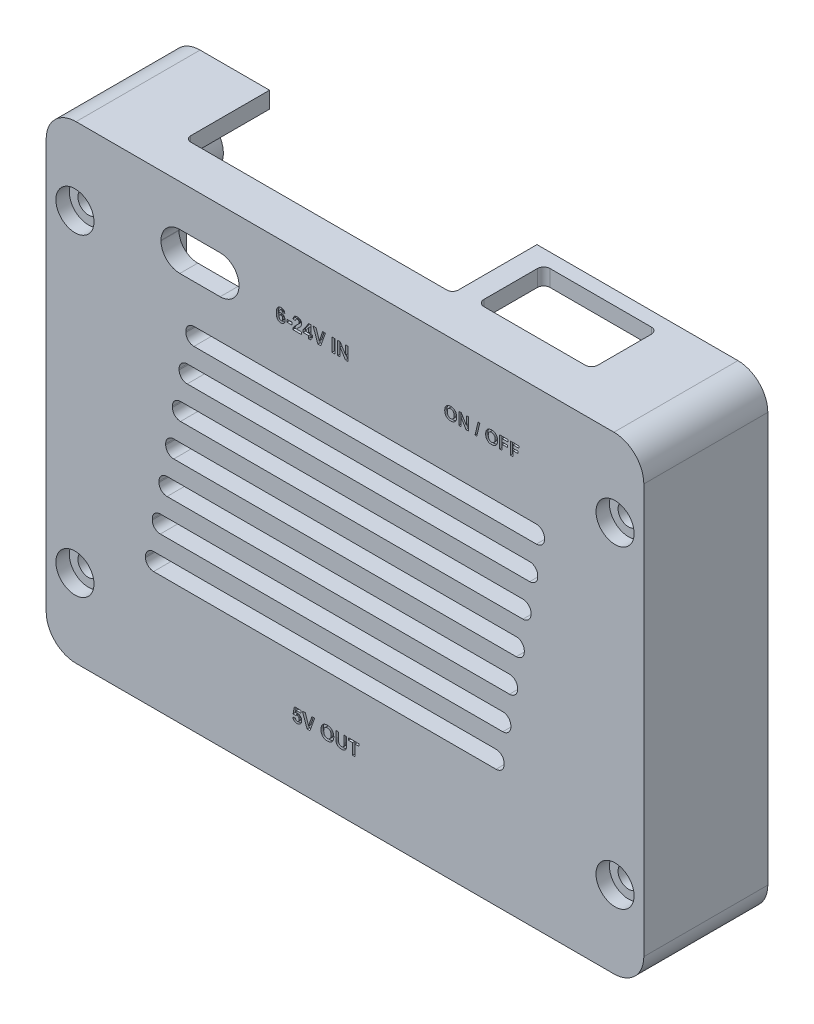
from build123d import *

# Parameters (mm, degrees)
UPPER_CASE_BLANK_START                       = 8
UPPER_CASE_BLANK_DEPTH                       = 16.6
UPPER_CASE_CAVITY_2P2_WALL_START             = 7.5
UPPER_CASE_CAVITY_2P2_WALL_DEPTH             = 14.7
UPPER_LID_SCREW_GUIDES_START                 = 8
UPPER_LID_SCREW_GUIDES_PROFILE_R             = 3.27
UPPER_LID_SCREW_GUIDES_DEPTH                 = 14.3
FOUR_M2P5_LID_CLEARANCE_HOLES_D2P8_START     = 7.5
LID_M2P5_CLEARANCE_PROFILES_R                = 1.4
FOUR_M2P5_LID_CLEARANCE_HOLES_D2P8_DEPTH     = 17.6
FOUR_D5P1_HEAD_COUNTERBORES_START            = 22.8
LID_SCREW_HEAD_RECESS_PROFILES_R             = 2.55
FOUR_D5P1_HEAD_COUNTERBORES_DEPTH            = 2.2
ROOF_VENT_SLOTS_START                        = 21.9
ROOF_VENT_SLOTS_DEPTH                        = 3.05
TWO_KF301_DRIVER_ACCESS_D4P9_START           = 21.9
TERMINAL_DRIVER_ACCESS_PROFILES_R            = 2.45
TWO_KF301_DRIVER_ACCESS_D4P9_DEPTH           = 3.05
OUTPUT_WINDOWS_USB_C_PH_DC_HEADER_START      = -32.4
OUTPUT_WINDOWS_USB_C_PH_DC_HEADER_DEPTH      = 3.9
INPUT_WINDOWS_KF301_XH_DC_SWITCH_START       = 32.4
INPUT_WINDOWS_KF301_XH_DC_SWITCH_DEPTH       = 3.9
INPUT_LABEL_START                            = 24.29
INPUT_LABEL_LETTER_PROFILES_W                = 0.66647
INPUT_LABEL_LETTER_PROFILES_H                = 0.33927
INPUT_LABEL_LETTER_PROFILES_W_2              = 0.35738
INPUT_LABEL_LETTER_PROFILES_H_2              = 1.77
INPUT_LABEL_DEPTH                            = 0.5
OUTPUT_LABEL_START                           = 24.29
OUTPUT_LABEL_DEPTH                           = 0.5
SWITCH_LABEL_START                           = 24.29
SWITCH_LABEL_DEPTH                           = 0.5
CONTINUOUS_TERMINAL_DRIVER_ACCESS_SLOT_START = 21.92
CONTINUOUS_TERMINAL_DRIVER_ACCESS_SLOT_DEPTH = 2.95


with BuildPart() as part:
    # Lid_Envelope_80x62p8_R4 → Upper_Case_Blank (new body)
    with BuildSketch(Plane.XY.offset(UPPER_CASE_BLANK_START)):
        with BuildLine():
            Line((-36, -31.4), (36, -31.4))
            ThreePointArc((36, -31.4), (38.828427125, -30.228427125), (40, -27.4))
            Line((40, -27.4), (40, 27.4))
            ThreePointArc((40, 27.4), (38.828427125, 30.228427125), (36, 31.4))
            Line((36, 31.4), (-36, 31.4))
            ThreePointArc((-36, 31.4), (-38.828427125, 30.228427125), (-40, 27.4))
            Line((-40, 27.4), (-40, -27.4))
            ThreePointArc((-40, -27.4), (-38.828427125, -30.228427125), (-36, -31.4))
        make_face()
    extrude(amount=UPPER_CASE_BLANK_DEPTH)

    # Upper_Case_Cavity_2p2_Wall_Profile → Upper_Case_Cavity_2p2_Wall (cut)
    with BuildSketch(Plane.XY.offset(UPPER_CASE_CAVITY_2P2_WALL_START)):
        with BuildLine():
            Line((-36, -29.2), (36, -29.2))
            ThreePointArc((36, -29.2), (37.272792206, -28.672792206), (37.8, -27.4))
            Line((37.8, -27.4), (37.8, 27.4))
            ThreePointArc((37.8, 27.4), (37.272792206, 28.672792206), (36, 29.2))
            Line((36, 29.2), (-36, 29.2))
            ThreePointArc((-36, 29.2), (-37.272792206, 28.672792206), (-37.8, 27.4))
            Line((-37.8, 27.4), (-37.8, -27.4))
            ThreePointArc((-37.8, -27.4), (-37.272792206, -28.672792206), (-36, -29.2))
        make_face()
    extrude(amount=UPPER_CASE_CAVITY_2P2_WALL_DEPTH, mode=Mode.SUBTRACT)

    # Upper_Lid_Screw_Guides_Profile → Upper_Lid_Screw_Guides (add)
    with BuildSketch(Plane.XY.offset(UPPER_LID_SCREW_GUIDES_START)):
        with Locations((-36.15, -21)):
            Circle(UPPER_LID_SCREW_GUIDES_PROFILE_R)
        with Locations((-36.15, 21)):
            Circle(UPPER_LID_SCREW_GUIDES_PROFILE_R)
        with Locations((36.15, -21)):
            Circle(UPPER_LID_SCREW_GUIDES_PROFILE_R)
        with Locations((36.15, 21)):
            Circle(UPPER_LID_SCREW_GUIDES_PROFILE_R)
    extrude(amount=UPPER_LID_SCREW_GUIDES_DEPTH)

    # Lid_M2p5_Clearance_Profiles → Four_M2p5_Lid_Clearance_Holes_D2p8 (cut)
    with BuildSketch(Plane.XY.offset(FOUR_M2P5_LID_CLEARANCE_HOLES_D2P8_START)):
        with Locations((-36.15, -21)):
            Circle(LID_M2P5_CLEARANCE_PROFILES_R)
        with Locations((-36.15, 21)):
            Circle(LID_M2P5_CLEARANCE_PROFILES_R)
        with Locations((36.15, -21)):
            Circle(LID_M2P5_CLEARANCE_PROFILES_R)
        with Locations((36.15, 21)):
            Circle(LID_M2P5_CLEARANCE_PROFILES_R)
    extrude(amount=FOUR_M2P5_LID_CLEARANCE_HOLES_D2P8_DEPTH, mode=Mode.SUBTRACT)

    # Lid_Screw_Head_Recess_Profiles → Four_D5p1_Head_Counterbores (cut)
    with BuildSketch(Plane.XY.offset(FOUR_D5P1_HEAD_COUNTERBORES_START)):
        with Locations((-36.15, -21)):
            Circle(LID_SCREW_HEAD_RECESS_PROFILES_R)
        with Locations((-36.15, 21)):
            Circle(LID_SCREW_HEAD_RECESS_PROFILES_R)
        with Locations((36.15, -21)):
            Circle(LID_SCREW_HEAD_RECESS_PROFILES_R)
        with Locations((36.15, 21)):
            Circle(LID_SCREW_HEAD_RECESS_PROFILES_R)
    extrude(amount=FOUR_D5P1_HEAD_COUNTERBORES_DEPTH, mode=Mode.SUBTRACT)

    # Seven_Roof_Vent_Profiles → Roof_Vent_Slots (cut)
    with BuildSketch(Plane.XY.offset(ROOF_VENT_SLOTS_START)):
        with BuildLine():
            Line((-25.62, -15.56), (20.22, -15.56))
            ThreePointArc((20.22, -15.56), (20.983675324, -15.243675324), (21.3, -14.48))
            Line((21.3, -14.48), (21.3, -14.32))
            ThreePointArc((21.3, -14.32), (20.983675324, -13.556324676), (20.22, -13.24))
            Line((20.22, -13.24), (-25.62, -13.24))
            ThreePointArc((-25.62, -13.24), (-26.383675324, -13.556324676), (-26.7, -14.32))
            Line((-26.7, -14.32), (-26.7, -14.48))
            ThreePointArc((-26.7, -14.48), (-26.383675324, -15.243675324), (-25.62, -15.56))
        make_face()
        with BuildLine():
            Line((-24.72, -10.76), (21.12, -10.76))
            ThreePointArc((21.12, -10.76), (21.883675324, -10.443675324), (22.2, -9.68))
            Line((22.2, -9.68), (22.2, -9.52))
            ThreePointArc((22.2, -9.52), (21.883675324, -8.756324676), (21.12, -8.44))
            Line((21.12, -8.44), (-24.72, -8.44))
            ThreePointArc((-24.72, -8.44), (-25.483675324, -8.756324676), (-25.8, -9.52))
            Line((-25.8, -9.52), (-25.8, -9.68))
            ThreePointArc((-25.8, -9.68), (-25.483675324, -10.443675324), (-24.72, -10.76))
        make_face()
        with BuildLine():
            Line((-23.82, -5.96), (22.02, -5.96))
            ThreePointArc((22.02, -5.96), (22.783675324, -5.643675324), (23.1, -4.88))
            Line((23.1, -4.88), (23.1, -4.72))
            ThreePointArc((23.1, -4.72), (22.783675324, -3.956324676), (22.02, -3.64))
            Line((22.02, -3.64), (-23.82, -3.64))
            ThreePointArc((-23.82, -3.64), (-24.583675324, -3.956324676), (-24.9, -4.72))
            Line((-24.9, -4.72), (-24.9, -4.88))
            ThreePointArc((-24.9, -4.88), (-24.583675324, -5.643675324), (-23.82, -5.96))
        make_face()
        with BuildLine():
            Line((-22.92, -1.16), (22.92, -1.16))
            ThreePointArc((22.92, -1.16), (23.683675324, -0.843675324), (24, -0.08))
            Line((24, -0.08), (24, 0.08))
            ThreePointArc((24, 0.08), (23.683675324, 0.843675324), (22.92, 1.16))
            Line((22.92, 1.16), (-22.92, 1.16))
            ThreePointArc((-22.92, 1.16), (-23.683675324, 0.843675324), (-24, 0.08))
            Line((-24, 0.08), (-24, -0.08))
            ThreePointArc((-24, -0.08), (-23.683675324, -0.843675324), (-22.92, -1.16))
        make_face()
        with BuildLine():
            Line((-22.02, 3.64), (23.82, 3.64))
            ThreePointArc((23.82, 3.64), (24.583675324, 3.956324676), (24.9, 4.72))
            Line((24.9, 4.72), (24.9, 4.88))
            ThreePointArc((24.9, 4.88), (24.583675324, 5.643675324), (23.82, 5.96))
            Line((23.82, 5.96), (-22.02, 5.96))
            ThreePointArc((-22.02, 5.96), (-22.783675324, 5.643675324), (-23.1, 4.88))
            Line((-23.1, 4.88), (-23.1, 4.72))
            ThreePointArc((-23.1, 4.72), (-22.783675324, 3.956324676), (-22.02, 3.64))
        make_face()
        with BuildLine():
            Line((-21.12, 8.44), (24.72, 8.44))
            ThreePointArc((24.72, 8.44), (25.483675324, 8.756324676), (25.8, 9.52))
            Line((25.8, 9.52), (25.8, 9.68))
            ThreePointArc((25.8, 9.68), (25.483675324, 10.443675324), (24.72, 10.76))
            Line((24.72, 10.76), (-21.12, 10.76))
            ThreePointArc((-21.12, 10.76), (-21.883675324, 10.443675324), (-22.2, 9.68))
            Line((-22.2, 9.68), (-22.2, 9.52))
            ThreePointArc((-22.2, 9.52), (-21.883675324, 8.756324676), (-21.12, 8.44))
        make_face()
        with BuildLine():
            Line((-20.22, 13.24), (25.62, 13.24))
            ThreePointArc((25.62, 13.24), (26.383675324, 13.556324676), (26.7, 14.32))
            Line((26.7, 14.32), (26.7, 14.48))
            ThreePointArc((26.7, 14.48), (26.383675324, 15.243675324), (25.62, 15.56))
            Line((25.62, 15.56), (-20.22, 15.56))
            ThreePointArc((-20.22, 15.56), (-20.983675324, 15.243675324), (-21.3, 14.48))
            Line((-21.3, 14.48), (-21.3, 14.32))
            ThreePointArc((-21.3, 14.32), (-20.983675324, 13.556324676), (-20.22, 13.24))
        make_face()
    extrude(amount=ROOF_VENT_SLOTS_DEPTH, mode=Mode.SUBTRACT)

    # Terminal_Driver_Access_Profiles → Two_KF301_Driver_Access_D4p9 (cut)
    with BuildSketch(Plane.XY.offset(TWO_KF301_DRIVER_ACCESS_D4P9_START)):
        with Locations((-21.95, 23.3)):
            Circle(TERMINAL_DRIVER_ACCESS_PROFILES_R)
        with Locations((-16.87, 23.3)):
            Circle(TERMINAL_DRIVER_ACCESS_PROFILES_R)
    extrude(amount=TWO_KF301_DRIVER_ACCESS_D4P9_DEPTH, mode=Mode.SUBTRACT)

    # Output_Windows_USB_C_PH_DC_Header_Profile → Output_Windows_USB_C_PH_DC_Header (cut)
    with BuildSketch(Plane(origin=(0, 0, 0), x_dir=(1, 0, 0), z_dir=(0, 1, 0)).offset(OUTPUT_WINDOWS_USB_C_PH_DC_HEADER_START)):
        with BuildLine():
            Line((10.62, -15.25), (25.6, -15.25))
            ThreePointArc((25.6, -15.25), (26.094974747, -15.044974747), (26.3, -14.55))
            Line((26.3, -14.55), (26.3, -6.85))
            ThreePointArc((26.3, -6.85), (26.094974747, -6.355025253), (25.6, -6.15))
            Line((25.6, -6.15), (10.62, -6.15))
            ThreePointArc((10.62, -6.15), (10.125025253, -6.355025253), (9.92, -6.85))
            Line((9.92, -6.85), (9.92, -14.55))
            ThreePointArc((9.92, -14.55), (10.125025253, -15.044974747), (10.62, -15.25))
        make_face()
        Polygon((-28.53, -5.65), (7.8, -5.65), (8.45, -6.3), (8.45, -17.9), (7.8, -18.55), (-3.4, -18.55), (-4.05, -17.9), (-4.05, -14.03), (-4.7, -13.38), (-28.53, -13.38), (-29.18, -12.73), (-29.18, -6.3), align=None)
    extrude(amount=OUTPUT_WINDOWS_USB_C_PH_DC_HEADER_DEPTH, mode=Mode.SUBTRACT)

    # Input_Windows_KF301_XH_DC_Switch_Profile → Input_Windows_KF301_XH_DC_Switch (cut)
    with BuildSketch(Plane(origin=(0, 0, 0), x_dir=(1, 0, 0), z_dir=(0, 1, 0)).offset(INPUT_WINDOWS_KF301_XH_DC_SWITCH_START)):
        with BuildLine():
            Line((-25.95, -19.3), (8.35, -19.3))
            ThreePointArc((8.35, -19.3), (8.880330086, -19.080330086), (9.1, -18.55))
            Line((9.1, -18.55), (9.1, -6.9))
            ThreePointArc((9.1, -6.9), (8.880330086, -6.369669914), (8.35, -6.15))
            Line((8.35, -6.15), (-25.95, -6.15))
            ThreePointArc((-25.95, -6.15), (-26.480330086, -6.369669914), (-26.7, -6.9))
            Line((-26.7, -6.9), (-26.7, -18.55))
            ThreePointArc((-26.7, -18.55), (-26.480330086, -19.080330086), (-25.95, -19.3))
        make_face()
        with BuildLine():
            Line((12.75, -18.75), (26.3, -18.75))
            ThreePointArc((26.3, -18.75), (26.901040764, -18.501040764), (27.15, -17.9))
            Line((27.15, -17.9), (27.15, -10.75))
            ThreePointArc((27.15, -10.75), (26.901040764, -10.148959236), (26.3, -9.9))
            Line((26.3, -9.9), (12.75, -9.9))
            ThreePointArc((12.75, -9.9), (12.148959236, -10.148959236), (11.9, -10.75))
            Line((11.9, -10.75), (11.9, -17.9))
            ThreePointArc((11.9, -17.9), (12.148959236, -18.501040764), (12.75, -18.75))
        make_face()
    extrude(amount=-INPUT_WINDOWS_KF301_XH_DC_SWITCH_DEPTH, mode=Mode.SUBTRACT)

    # Input_Label_Letter_Profiles → Input_Label (cut)
    # profile 1 of 7: a face of its own
    with BuildSketch(Plane.XY.offset(INPUT_LABEL_START)):
        Polygon((-8.04555, 23.13656), (-8.37395, 23.10033), (-8.39568, 23.18847), (-8.43673, 23.25005), (-8.49499, 23.28627), (-8.56834, 23.29834), (-8.66749, 23.2742), (-8.75004, 23.20175), (-8.78374, 23.1404), (-8.81056, 23.05295), (-8.83052, 22.93938), (-8.84362, 22.7997), (-8.75226, 22.88287), (-8.64722, 22.93278), (-8.52849, 22.94941), (-8.42605, 22.9393), (-8.33124, 22.90897), (-8.24404, 22.85841), (-8.16447, 22.78763), (-8.09818, 22.70085), (-8.05083, 22.6023), (-8.02242, 22.49197), (-8.01295, 22.36988), (-8.01932, 22.26551), (-8.03845, 22.16974), (-8.07032, 22.08257), (-8.11495, 22.004), (-8.17232, 21.93402), (-8.25766, 21.86218), (-8.35433, 21.81087), (-8.46231, 21.78008), (-8.58162, 21.76982), (-8.68502, 21.77815), (-8.78078, 21.80314), (-8.86892, 21.84479), (-8.94943, 21.90311), (-9.02231, 21.97809), (-9.08446, 22.07204), (-9.1328, 22.1873), (-9.16733, 22.32385), (-9.18805, 22.4817), (-9.19496, 22.66085), (-9.18776, 22.84461), (-9.16618, 23.00664), (-9.1302, 23.14694), (-9.07982, 23.2655), (-9.01506, 23.36233), (-8.9388, 23.4397), (-8.85395, 23.49988), (-8.7605, 23.54286), (-8.65845, 23.56865), (-8.54781, 23.57724), (-8.4211, 23.5647), (-8.30982, 23.52707), (-8.21397, 23.46436), (-8.15387, 23.40153), (-8.10576, 23.32596), (-8.06966, 23.23763), align=None)
        Polygon((-8.81464, 22.39644), (-8.80619, 22.29455), (-8.78083, 22.20943), (-8.73857, 22.14108), (-8.65708, 22.07362), (-8.56471, 22.05113), (-8.47839, 22.06954), (-8.40776, 22.12478), (-8.36067, 22.22197), (-8.34497, 22.36626), (-8.35249, 22.47109), (-8.37502, 22.55541), (-8.41259, 22.6192), (-8.48865, 22.67942), (-8.58162, 22.69949), (-8.67187, 22.68032), (-8.74703, 22.62282), (-8.79774, 22.52789), align=None, mode=Mode.SUBTRACT)
    # profile 2 of 7: a face of its own
    with BuildSketch(Plane.XY.offset(INPUT_LABEL_START)):
        with Locations((-7.430995, 22.441715)):
            Rectangle(INPUT_LABEL_LETTER_PROFILES_W, INPUT_LABEL_LETTER_PROFILES_H)
    # profile 3 of 7: a face of its own
    with BuildSketch(Plane.XY.offset(INPUT_LABEL_START)):
        Polygon((-5.80709, 22.11512), (-5.80709, 21.8), (-6.99634, 21.8), (-6.97488, 21.91705), (-6.93624, 22.02994), (-6.88044, 22.13867), (-6.83427, 22.20683), (-6.77303, 22.28336), (-6.69672, 22.36824), (-6.60535, 22.46147), (-6.49891, 22.56306), (-6.3953, 22.66131), (-6.31388, 22.74235), (-6.25464, 22.80619), (-6.21759, 22.85282), (-6.16507, 22.95726), (-6.14756, 23.06049), (-6.16281, 23.16085), (-6.20854, 23.23496), (-6.28113, 23.28068), (-6.37696, 23.29593), (-6.47235, 23.27993), (-6.546, 23.23194), (-6.5955, 23.14682), (-6.61844, 23.01944), (-6.9565, 23.05325), (-6.93333, 23.18342), (-6.89402, 23.29381), (-6.83856, 23.38444), (-6.76694, 23.4553), (-6.68228, 23.50865), (-6.58765, 23.54676), (-6.48306, 23.56962), (-6.36851, 23.57724), (-6.24453, 23.56842), (-6.13459, 23.54193), (-6.03868, 23.49778), (-5.9568, 23.43598), (-5.8913, 23.36105), (-5.84452, 23.27752), (-5.81644, 23.18538), (-5.80709, 23.08464), (-5.8178, 22.96798), (-5.84995, 22.85705), (-5.90534, 22.74642), (-5.98578, 22.63067), (-6.03783, 22.5707), (-6.11188, 22.49544), (-6.20793, 22.40489), (-6.30191, 22.31769), (-6.36972, 22.25249), (-6.41137, 22.2093), (-6.45016, 22.16161), (-6.4808, 22.11512), align=None)
    # profile 4 of 7: a face of its own
    with BuildSketch(Plane.XY.offset(INPUT_LABEL_START)):
        Polygon((-4.8907, 21.8), (-4.8907, 22.15617), (-5.61512, 22.15617), (-5.61512, 22.45319), (-4.84723, 23.57724), (-4.56229, 23.57724), (-4.56229, 22.45439), (-4.34255, 22.45439), (-4.34255, 22.15617), (-4.56229, 22.15617), (-4.56229, 21.8), align=None)
        Polygon((-4.8907, 22.45439), (-4.8907, 23.05928), (-5.29758, 22.45439), align=None, mode=Mode.SUBTRACT)
    # profile 5 of 7: a face of its own
    with BuildSketch(Plane.XY.offset(INPUT_LABEL_START)):
        Polygon((-3.63262, 21.8), (-4.26528, 23.57), (-3.87771, 23.57), (-3.42978, 22.26001), (-2.99634, 23.57), (-2.61722, 23.57), (-3.25109, 21.8), align=None)
    # profile 6 of 7: a face of its own
    with BuildSketch(Plane.XY.offset(INPUT_LABEL_START)):
        with Locations((-1.53663, 22.685)):
            Rectangle(INPUT_LABEL_LETTER_PROFILES_W_2, INPUT_LABEL_LETTER_PROFILES_H_2)
    # profile 7 of 7: a face of its own
    with BuildSketch(Plane.XY.offset(INPUT_LABEL_START)):
        Polygon((-0.99211, 21.8), (-0.99211, 23.57), (-0.64439, 23.57), (0.08003, 22.38799), (0.08003, 23.57), (0.41206, 23.57), (0.41206, 21.8), (0.05347, 21.8), (-0.66008, 22.95424), (-0.66008, 21.8), align=None)
    extrude(amount=INPUT_LABEL_DEPTH, mode=Mode.SUBTRACT)

    # Output_Label_Letter_Profiles → Output_Label (cut)
    # profile 1 of 5: a face of its own
    with BuildSketch(Plane.XY.offset(OUTPUT_LABEL_START)):
        Polygon((-6.99013, -23.09482), (-6.65207, -23.05981), (-6.62339, -23.16259), (-6.56634, -23.24152), (-6.48968, -23.29177), (-6.40214, -23.30853), (-6.30404, -23.28694), (-6.22224, -23.2222), (-6.18133, -23.15492), (-6.15678, -23.06819), (-6.14859, -22.96201), (-6.16686, -22.81939), (-6.22164, -22.71752), (-6.3057, -22.6564), (-6.4118, -22.63602), (-6.50584, -22.65038), (-6.59317, -22.69344), (-6.6738, -22.76521), (-6.94908, -22.72537), (-6.77522, -21.80415), (-5.87814, -21.80415), (-5.87814, -22.12168), (-6.51805, -22.12168), (-6.57117, -22.42232), (-6.45647, -22.37976), (-6.33936, -22.36557), (-6.23077, -22.37584), (-6.13079, -22.40662), (-6.0394, -22.45794), (-5.95662, -22.52977), (-5.88795, -22.61799), (-5.83891, -22.71843), (-5.80948, -22.83109), (-5.79967, -22.95598), (-5.80759, -23.0623), (-5.83136, -23.16274), (-5.87098, -23.25729), (-5.92644, -23.34595), (-6.00086, -23.43028), (-6.086, -23.49586), (-6.18187, -23.54271), (-6.28846, -23.57082), (-6.40576, -23.58018), (-6.52265, -23.57196), (-6.62822, -23.54728), (-6.72247, -23.50616), (-6.8054, -23.44858), (-6.8749, -23.37712), (-6.92886, -23.29434), (-6.96727, -23.20024), align=None)
    # profile 2 of 5: a face of its own
    with BuildSketch(Plane.XY.offset(OUTPUT_LABEL_START)):
        Polygon((-5.07162, -23.55), (-5.70428, -21.78), (-5.31672, -21.78), (-4.86879, -23.08999), (-4.43534, -21.78), (-4.05623, -21.78), (-4.6901, -23.55), align=None)
    # profile 3 of 5: a face of its own
    with BuildSketch(Plane.XY.offset(OUTPUT_LABEL_START)):
        Polygon((-3.2159, -22.67587), (-3.21084, -22.54607), (-3.19568, -22.42715), (-3.1704, -22.31909), (-3.13501, -22.2219), (-3.08986, -22.13483), (-3.03493, -22.05394), (-2.9702, -21.97922), (-2.89836, -21.91375), (-2.8221, -21.86063), (-2.74141, -21.81984), (-2.65553, -21.78921), (-2.56332, -21.76732), (-2.46477, -21.75419), (-2.35988, -21.74982), (-2.20966, -21.75952), (-2.07194, -21.78864), (-1.94674, -21.83718), (-1.83404, -21.90513), (-1.73386, -21.9925), (-1.64932, -22.09715), (-1.58356, -22.21697), (-1.5366, -22.35195), (-1.50842, -22.5021), (-1.49902, -22.66741), (-1.50835, -22.8314), (-1.53631, -22.98046), (-1.58291, -23.1146), (-1.64816, -23.23381), (-1.73205, -23.33811), (-1.83153, -23.42525), (-1.94358, -23.49304), (-2.06818, -23.54145), (-2.20533, -23.5705), (-2.35505, -23.58018), (-2.5065, -23.57055), (-2.64501, -23.54165), (-2.77058, -23.49347), (-2.8832, -23.42603), (-2.98288, -23.33931), (-3.06677, -23.2357), (-3.13201, -23.11755), (-3.17862, -22.98486), (-3.20658, -22.83763), align=None)
        Polygon((-2.84765, -22.66379), (-2.8421, -22.77823), (-2.82544, -22.88102), (-2.79767, -22.97218), (-2.75879, -23.0517), (-2.70881, -23.11957), (-2.6347, -23.18745), (-2.55124, -23.23593), (-2.45843, -23.26502), (-2.35626, -23.27472), (-2.25419, -23.2651), (-2.16172, -23.23624), (-2.07882, -23.18813), (-2.00552, -23.12078), (-1.95618, -23.05305), (-1.91781, -22.973), (-1.8904, -22.88064), (-1.87396, -22.77596), (-1.86848, -22.65896), (-1.87382, -22.54344), (-1.88983, -22.44028), (-1.91651, -22.34949), (-1.95386, -22.27106), (-2.00189, -22.20499), (-2.07407, -22.13949), (-2.15719, -22.09271), (-2.25125, -22.06464), (-2.35626, -22.05528), (-2.46137, -22.06475), (-2.55577, -22.09316), (-2.63946, -22.14051), (-2.71243, -22.2068), (-2.76111, -22.27357), (-2.79897, -22.35265), (-2.82602, -22.44405), (-2.84224, -22.54776), align=None, mode=Mode.SUBTRACT)
    # profile 4 of 5: a face of its own
    with BuildSketch(Plane.XY.offset(OUTPUT_LABEL_START)):
        Polygon((-1.2008, -21.78), (-0.84342, -21.78), (-0.84342, -22.73865), (-0.84195, -22.87294), (-0.83752, -22.97154), (-0.83014, -23.03445), (-0.79136, -23.1324), (-0.72088, -23.20892), (-0.6187, -23.25827), (-0.48484, -23.27472), (-0.35142, -23.25918), (-0.25544, -23.21254), (-0.19356, -23.14327), (-0.16247, -23.05981), (-0.15375, -22.98616), (-0.14852, -22.88595), (-0.14677, -22.75917), (-0.14677, -21.78), (0.21061, -21.78), (0.21061, -22.70967), (0.2088, -22.85735), (0.20336, -22.98163), (0.19431, -23.08252), (0.18163, -23.16002), (0.14043, -23.28136), (0.07478, -23.38218), (-0.01623, -23.46352), (-0.13349, -23.52646), (-0.22928, -23.55631), (-0.34277, -23.57421), (-0.47397, -23.58018), (-0.59308, -23.57652), (-0.69688, -23.56554), (-0.78536, -23.54725), (-0.85852, -23.52163), (-0.97578, -23.45432), (-1.06558, -23.3695), (-1.12866, -23.27366), (-1.16579, -23.1733), (-1.18111, -23.08818), (-1.19205, -22.98495), (-1.19862, -22.86361), (-1.2008, -22.72416), align=None)
    # profile 5 of 5: a face of its own
    with BuildSketch(Plane.XY.offset(OUTPUT_LABEL_START)):
        Polygon((1.00747, -23.55), (1.00747, -22.07943), (0.48226, -22.07943), (0.48226, -21.78), (1.88885, -21.78), (1.88885, -22.07943), (1.36485, -22.07943), (1.36485, -23.55), align=None)
    extrude(amount=OUTPUT_LABEL_DEPTH, mode=Mode.SUBTRACT)

    # Switch_Label_Letter_Profiles → Switch_Label (cut)
    # profile 1 of 6: a face of its own
    with BuildSketch(Plane.XY.offset(SWITCH_LABEL_START)):
        Polygon((13.35017, 22.61487), (13.35488, 22.73586), (13.36902, 22.84673), (13.39259, 22.94746), (13.42558, 23.03806), (13.46766, 23.11922), (13.51887, 23.19463), (13.57921, 23.26429), (13.68121, 23.35152), (13.7925, 23.41286), (13.90055, 23.44912), (14.0191, 23.47088), (14.14816, 23.47814), (14.28819, 23.46909), (14.41657, 23.44194), (14.53329, 23.3967), (14.63834, 23.33335), (14.73174, 23.25191), (14.81054, 23.15435), (14.87184, 23.04265), (14.91562, 22.91682), (14.94189, 22.77685), (14.95065, 22.62275), (14.94196, 22.46988), (14.91589, 22.33093), (14.87245, 22.20588), (14.81162, 22.09475), (14.73342, 21.99753), (14.64068, 21.91629), (14.53623, 21.8531), (14.42008, 21.80797), (14.29222, 21.78089), (14.15266, 21.77186), (14.01148, 21.78084), (13.88236, 21.80779), (13.7653, 21.8527), (13.66032, 21.91557), (13.56739, 21.9964), (13.48919, 22.09299), (13.42837, 22.20314), (13.38493, 22.32683), (13.35886, 22.46407), align=None)
        Polygon((13.69345, 22.62613), (13.70154, 22.49448), (13.72581, 22.37978), (13.76626, 22.28204), (13.82289, 22.20124), (13.89196, 22.13797), (13.96976, 22.09277), (14.05629, 22.06566), (14.15153, 22.05662), (14.24668, 22.06559), (14.33288, 22.09249), (14.41016, 22.13734), (14.4785, 22.20012), (14.53438, 22.28084), (14.57431, 22.3795), (14.59826, 22.49609), (14.60624, 22.63063), (14.59847, 22.76344), (14.57515, 22.87824), (14.53628, 22.97503), (14.48187, 23.05382), (14.41459, 23.11488), (14.3371, 23.15849), (14.24942, 23.18466), (14.15153, 23.19338), (14.05354, 23.18456), (13.96554, 23.15807), (13.88753, 23.11393), (13.81951, 23.05213), (13.76436, 22.97254), (13.72497, 22.875), (13.70133, 22.75953), align=None, mode=Mode.SUBTRACT)
    # profile 2 of 6: a face of its own
    with BuildSketch(Plane.XY.offset(SWITCH_LABEL_START)):
        Polygon((15.23428, 21.8), (15.23428, 23.45), (15.55842, 23.45), (16.23373, 22.34812), (16.23373, 23.45), (16.54325, 23.45), (16.54325, 21.8), (16.20897, 21.8), (15.54379, 22.87599), (15.54379, 21.8), align=None)
    # profile 3 of 6: a face of its own
    with BuildSketch(Plane.XY.offset(SWITCH_LABEL_START)):
        Polygon((17.40539, 21.77186), (17.81395, 23.47814), (18.05143, 23.47814), (17.63837, 21.77186), align=None)
    # profile 4 of 6: a face of its own
    with BuildSketch(Plane.XY.offset(SWITCH_LABEL_START)):
        Polygon((18.83029, 22.61487), (18.835, 22.73586), (18.84914, 22.84673), (18.8727, 22.94746), (18.9057, 23.03806), (18.94778, 23.11922), (18.99899, 23.19463), (19.05933, 23.26429), (19.16133, 23.35152), (19.27261, 23.41286), (19.38066, 23.44912), (19.49922, 23.47088), (19.62827, 23.47814), (19.76831, 23.46909), (19.89669, 23.44194), (20.0134, 23.3967), (20.11846, 23.33335), (20.21185, 23.25191), (20.29066, 23.15435), (20.35196, 23.04265), (20.39574, 22.91682), (20.42201, 22.77685), (20.43076, 22.62275), (20.42208, 22.46988), (20.39601, 22.33093), (20.35256, 22.20588), (20.29174, 22.09475), (20.21354, 21.99753), (20.1208, 21.91629), (20.01635, 21.8531), (19.9002, 21.80797), (19.77234, 21.78089), (19.63278, 21.77186), (19.49159, 21.78084), (19.36247, 21.80779), (19.24542, 21.8527), (19.14043, 21.91557), (19.04751, 21.9964), (18.96931, 22.09299), (18.90849, 22.20314), (18.86504, 22.32683), (18.83898, 22.46407), align=None)
        Polygon((19.17357, 22.62613), (19.18166, 22.49448), (19.20593, 22.37978), (19.24637, 22.28204), (19.303, 22.20124), (19.37208, 22.13797), (19.44988, 22.09277), (19.5364, 22.06566), (19.63165, 22.05662), (19.72679, 22.06559), (19.813, 22.09249), (19.89027, 22.13734), (19.95861, 22.20012), (20.0145, 22.28084), (20.05442, 22.3795), (20.07837, 22.49609), (20.08636, 22.63063), (20.07858, 22.76344), (20.05527, 22.87824), (20.0164, 22.97503), (19.96199, 23.05382), (19.8947, 23.11488), (19.81722, 23.15849), (19.72954, 23.18466), (19.63165, 23.19338), (19.53366, 23.18456), (19.44566, 23.15807), (19.36765, 23.11393), (19.29962, 23.05213), (19.24447, 22.97254), (19.20508, 22.875), (19.18145, 22.75953), align=None, mode=Mode.SUBTRACT)
    # profile 5 of 6: a face of its own
    with BuildSketch(Plane.XY.offset(SWITCH_LABEL_START)):
        Polygon((20.71327, 21.8), (20.71327, 23.45), (21.84441, 23.45), (21.84441, 23.17087), (21.04642, 23.17087), (21.04642, 22.78032), (21.73523, 22.78032), (21.73523, 22.50119), (21.04642, 22.50119), (21.04642, 21.8), align=None)
    # profile 6 of 6: a face of its own
    with BuildSketch(Plane.XY.offset(SWITCH_LABEL_START)):
        Polygon((22.14154, 21.8), (22.14154, 23.45), (23.27268, 23.45), (23.27268, 23.17087), (22.47469, 23.17087), (22.47469, 22.78032), (23.16351, 22.78032), (23.16351, 22.50119), (22.47469, 22.50119), (22.47469, 21.8), align=None)
    extrude(amount=SWITCH_LABEL_DEPTH, mode=Mode.SUBTRACT)

    # Terminal_Driver_Slot_10p44x5p10_Profile → Continuous_Terminal_Driver_Access_Slot (cut)
    with BuildSketch(Plane.XY.offset(CONTINUOUS_TERMINAL_DRIVER_ACCESS_SLOT_START)):
        with BuildLine():
            Line((-22.11, 20.75), (-16.71, 20.75))
            ThreePointArc((-16.71, 20.75), (-14.928090911, 21.488090911), (-14.19, 23.27))
            Line((-14.19, 23.27), (-14.19, 23.33))
            ThreePointArc((-14.19, 23.33), (-14.928090911, 25.111909089), (-16.71, 25.85))
            Line((-16.71, 25.85), (-22.11, 25.85))
            ThreePointArc((-22.11, 25.85), (-23.891909089, 25.111909089), (-24.63, 23.33))
            Line((-24.63, 23.33), (-24.63, 23.27))
            ThreePointArc((-24.63, 23.27), (-23.891909089, 21.488090911), (-22.11, 20.75))
        make_face()
    extrude(amount=CONTINUOUS_TERMINAL_DRIVER_ACCESS_SLOT_DEPTH, mode=Mode.SUBTRACT)


solid = part.part
